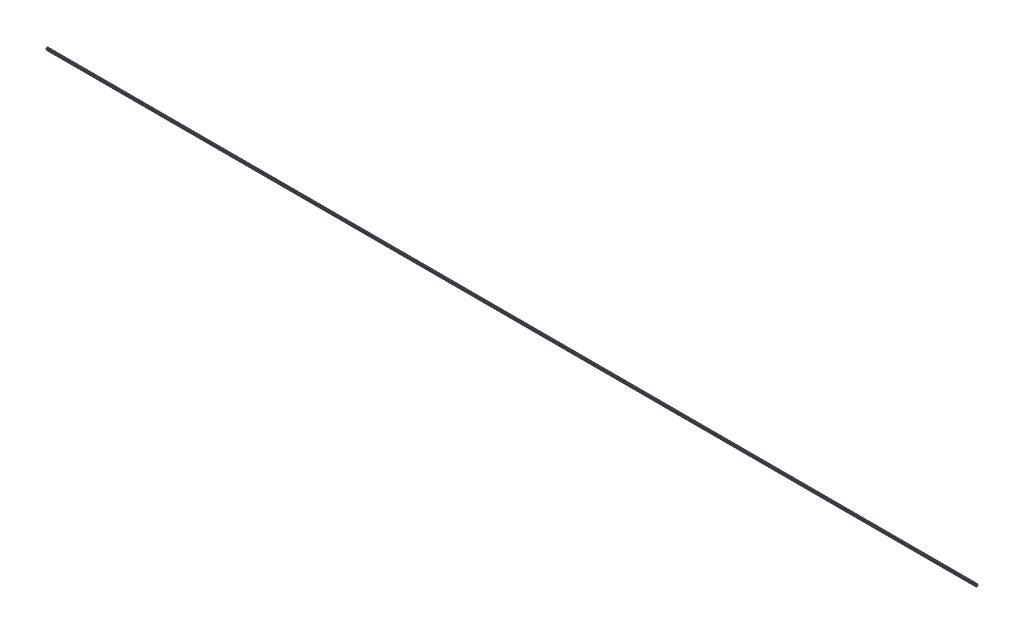
from build123d import *

# Parameters (mm, degrees)
SKETCH1_R           = 3.4
SKETCH1_R_2         = 2.1
BOSS_EXTRUDE1_DEPTH = 15000


with BuildPart() as part:
    # Sketch1 → Boss-Extrude1 (new body)
    with BuildSketch(Plane(origin=(0, 0, 0), x_dir=(0, -1, 0), z_dir=(-1, 0, 0))):
        with BuildLine():
            Line((13, -4), (13, -8.25))
            Line((13, -8.25), (9.664213562, -8.25))
            Line((9.664213562, -8.25), (6, -4.585786438))
            Line((6, -4.585786438), (6, -0.519615242))
            Line((6, -0.519615242), (5.7, 0))
            Line((5.7, 0), (6, 0.519615242))
            Line((6, 0.519615242), (6, 4.585786438))
            Line((6, 4.585786438), (9.664213562, 8.25))
            Line((9.664213562, 8.25), (13, 8.25))
            Line((13, 8.25), (13, 4))
            Line((13, 4), (15, 4))
            Line((15, 4), (15, 13))
            ThreePointArc((15, 13), (14.414213562, 14.414213562), (13, 15))
            Line((13, 15), (4, 15))
            Line((4, 15), (4, 13))
            Line((4, 13), (8.25, 13))
            Line((8.25, 13), (8.25, 9.664213562))
            Line((8.25, 9.664213562), (4.585786438, 6))
            Line((4.585786438, 6), (0.519615242, 6))
            Line((0.519615242, 6), (0, 5.7))
            Line((0, 5.7), (-0.519615242, 6))
            Line((-0.519615242, 6), (-4.585786438, 6))
            Line((-4.585786438, 6), (-8.25, 9.664213562))
            Line((-8.25, 9.664213562), (-8.25, 13))
            Line((-8.25, 13), (-4, 13))
            Line((-4, 13), (-4, 15))
            Line((-4, 15), (-13, 15))
            ThreePointArc((-13, 15), (-14.414213562, 14.414213562), (-15, 13))
            Line((-15, 13), (-15, 4))
            Line((-15, 4), (-13, 4))
            Line((-13, 4), (-13, 8.25))
            Line((-13, 8.25), (-9.664213562, 8.25))
            Line((-9.664213562, 8.25), (-6, 4.585786438))
            Line((-6, 4.585786438), (-6, 0.519615242))
            Line((-6, 0.519615242), (-5.7, 0))
            Line((-5.7, 0), (-6, -0.519615242))
            Line((-6, -0.519615242), (-6, -4.585786438))
            Line((-6, -4.585786438), (-9.664213562, -8.25))
            Line((-9.664213562, -8.25), (-13, -8.25))
            Line((-13, -8.25), (-13, -4))
            Line((-13, -4), (-15, -4))
            Line((-15, -4), (-15, -13))
            ThreePointArc((-15, -13), (-14.414213562, -14.414213562), (-13, -15))
            Line((-13, -15), (-4, -15))
            Line((-4, -15), (-4, -13))
            Line((-4, -13), (-8.25, -13))
            Line((-8.25, -13), (-8.25, -9.664213562))
            Line((-8.25, -9.664213562), (-4.585786438, -6))
            Line((-4.585786438, -6), (-0.519615242, -6))
            Line((-0.519615242, -6), (0, -5.7))
            Line((0, -5.7), (0.519615242, -6))
            Line((0.519615242, -6), (4.585786438, -6))
            Line((4.585786438, -6), (8.25, -9.664213562))
            Line((8.25, -9.664213562), (8.25, -13))
            Line((8.25, -13), (4, -13))
            Line((4, -13), (4, -15))
            Line((4, -15), (13, -15))
            ThreePointArc((13, -15), (14.414213562, -14.414213562), (15, -13))
            Line((15, -13), (15, -4))
            Line((15, -4), (13, -4))
        make_face()
        with Locations(Location((0, 0, 0), (0, 0, 270))):
            Circle(SKETCH1_R, mode=Mode.SUBTRACT)
        with Locations(Location((11.6, -11.6, 0), (0, 0, 270))):
            Circle(SKETCH1_R_2, mode=Mode.SUBTRACT)
        with Locations(Location((11.6, 11.6, 0), (0, 0, 270))):
            Circle(SKETCH1_R_2, mode=Mode.SUBTRACT)
        with Locations(Location((-11.6, 11.6, 0), (0, 0, 270))):
            Circle(SKETCH1_R_2, mode=Mode.SUBTRACT)
        with Locations(Location((-11.6, -11.6, 0), (0, 0, 270))):
            Circle(SKETCH1_R_2, mode=Mode.SUBTRACT)
    extrude(amount=-BOSS_EXTRUDE1_DEPTH)


solid = part.part
